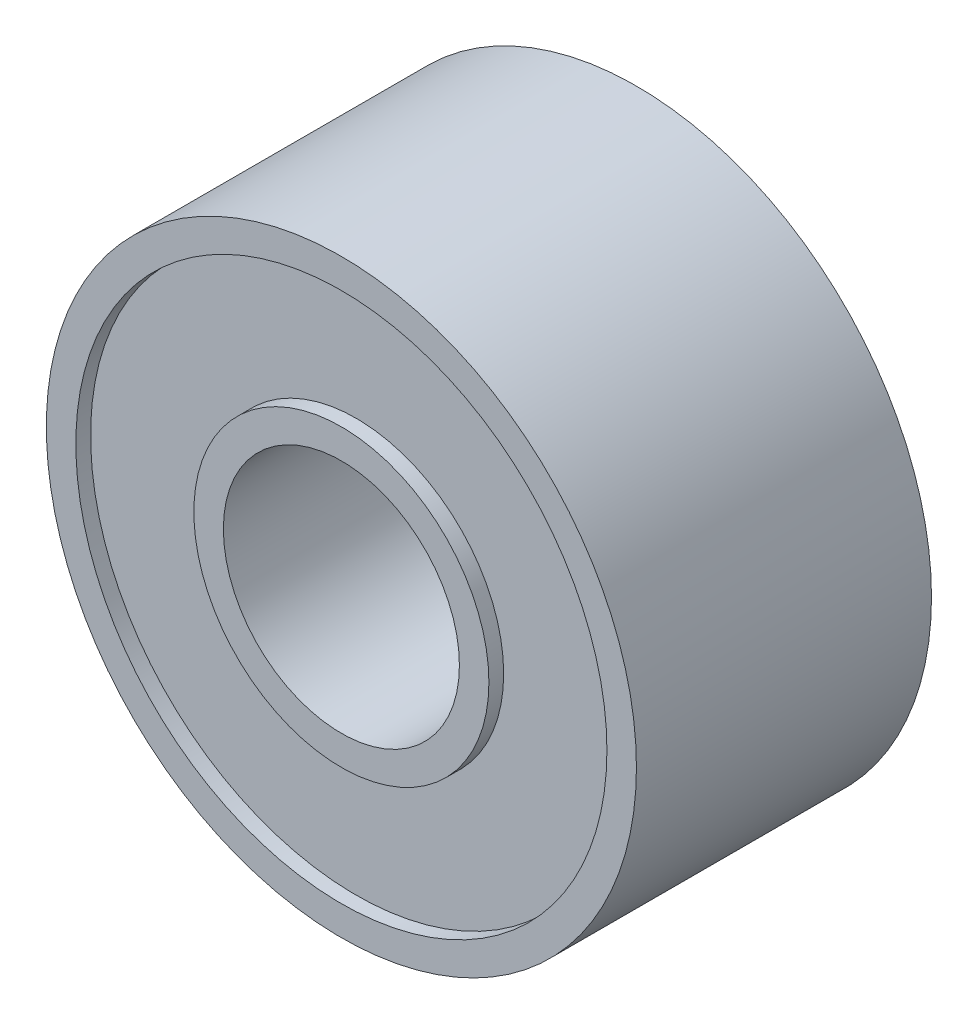
from build123d import *

# Parameters (mm, degrees)
SKETCH_1_R      = 9
SKETCH_1_R_2    = 5
EXTRUDE_1_DEPTH = 4.5
SKETCH_1_3_R    = 10
SKETCH_1_3_R_2  = 9
SKETCH_1_3_R_3  = 5
SKETCH_1_3_R_4  = 4
EXTRUDE_2_DEPTH = 5


with BuildPart() as part:
    # 草图1 → 凸台-拉伸1 (new, symmetric)
    with BuildSketch(Plane.XY):
        Circle(SKETCH_1_R)
        Circle(SKETCH_1_R_2, mode=Mode.SUBTRACT)
    extrude(amount=EXTRUDE_1_DEPTH, both=True)

    # 草图1<3> → 凸台-拉伸2 (add, symmetric)
    # profile 1 of 2: a face of its own
    with BuildSketch(Plane.XY):
        Circle(SKETCH_1_3_R)
        Circle(SKETCH_1_3_R_2, mode=Mode.SUBTRACT)
    # profile 2 of 2: a face of its own
    with BuildSketch(Plane.XY):
        Circle(SKETCH_1_3_R_3)
        Circle(SKETCH_1_3_R_4, mode=Mode.SUBTRACT)
    extrude(amount=EXTRUDE_2_DEPTH, both=True)


solid = part.part
